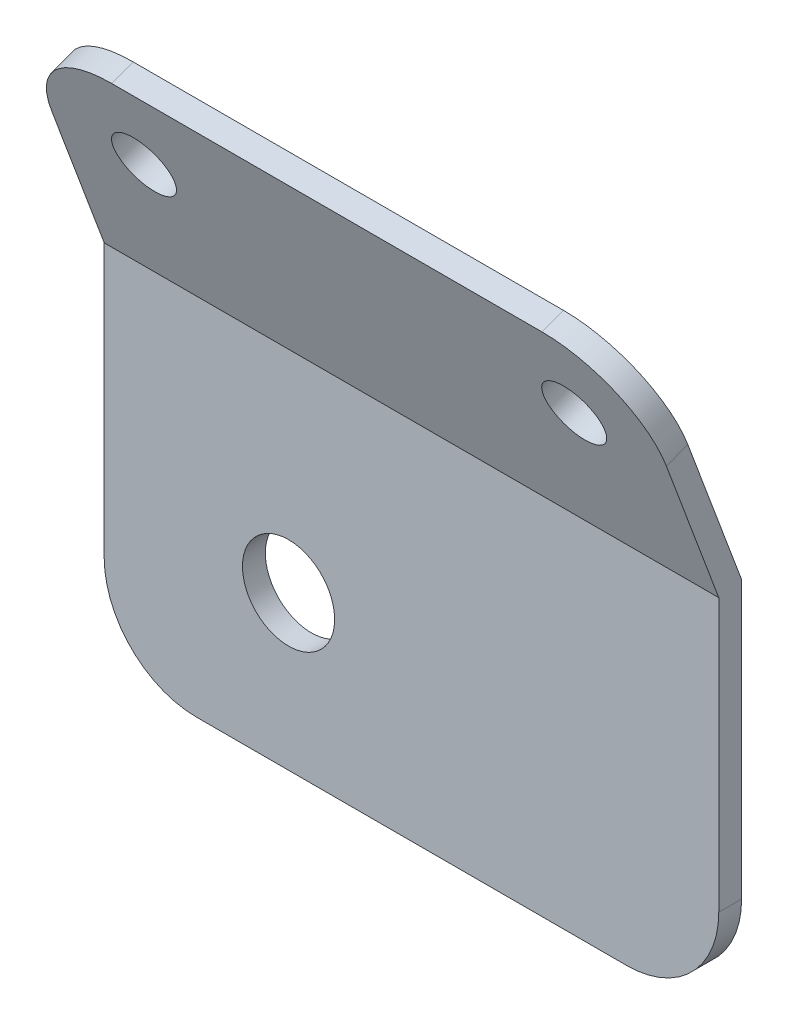
from build123d import *

# Parameters (mm, degrees)
EXTRUDE_THIN1_DEPTH = 31.75
SKETCH2_R           = 4.7625
CUT_EXTRUDE1_DEPTH  = 51.823787507
SKETCH3_R           = 3.175
CUT_EXTRUDE2_DEPTH  = 51.823787507
FILLET1_R           = 9.525


with BuildPart() as part:
    # Sketch1 → Extrude-Thin1 (new, symmetric)
    with BuildSketch(Plane(origin=(0, 0, 0), x_dir=(0, 0, -1), z_dir=(1, 0, 0))):
        Polygon((-8.895267484, 23.791473607), (0, 0), (0, -38.1), (-2.3622, -38.1), (-2.3622, -0.427155344), (-11.107874529, 22.964213731), align=None)
    extrude(amount=EXTRUDE_THIN1_DEPTH, both=True)

    # Sketch2 → Cut-Extrude1 (cut, through all)
    with BuildSketch(Plane(origin=(0, 0, 0), x_dir=(-1, 0, 0), z_dir=(0, 0, -1))):
        with Locations(Location((12.7, -22.225, 0), (0, 0, 90))):
            Circle(SKETCH2_R)
    extrude(amount=-CUT_EXTRUDE1_DEPTH, mode=Mode.SUBTRACT)

    # Sketch3 → Cut-Extrude2 (cut, through all)
    with BuildSketch(Plane(origin=(0, 0, 0), x_dir=(-1, 0, 0), z_dir=(0, 0.35020738125946876, -0.9366721892483971))):
        with Locations(Location((-22.225, 15.875, 0), (0, 0, 90))):
            Circle(SKETCH3_R)
        with Locations(Location((22.225, 15.875, 0), (0, 0, 90))):
            Circle(SKETCH3_R)
    extrude(amount=-CUT_EXTRUDE2_DEPTH, mode=Mode.SUBTRACT)

    # Fillet1
    fillet1_edges = [part.edges().sort_by_distance(p)[0] for p in [
        (31.75, 23.377843669, 10.001571007),
        (-31.75, 23.377843669, 10.001571007),
        (-31.75, -38.1, 1.1811),
        (31.75, -38.1, 1.1811),
    ]]
    fillet(fillet1_edges, radius=FILLET1_R)


solid = part.part
